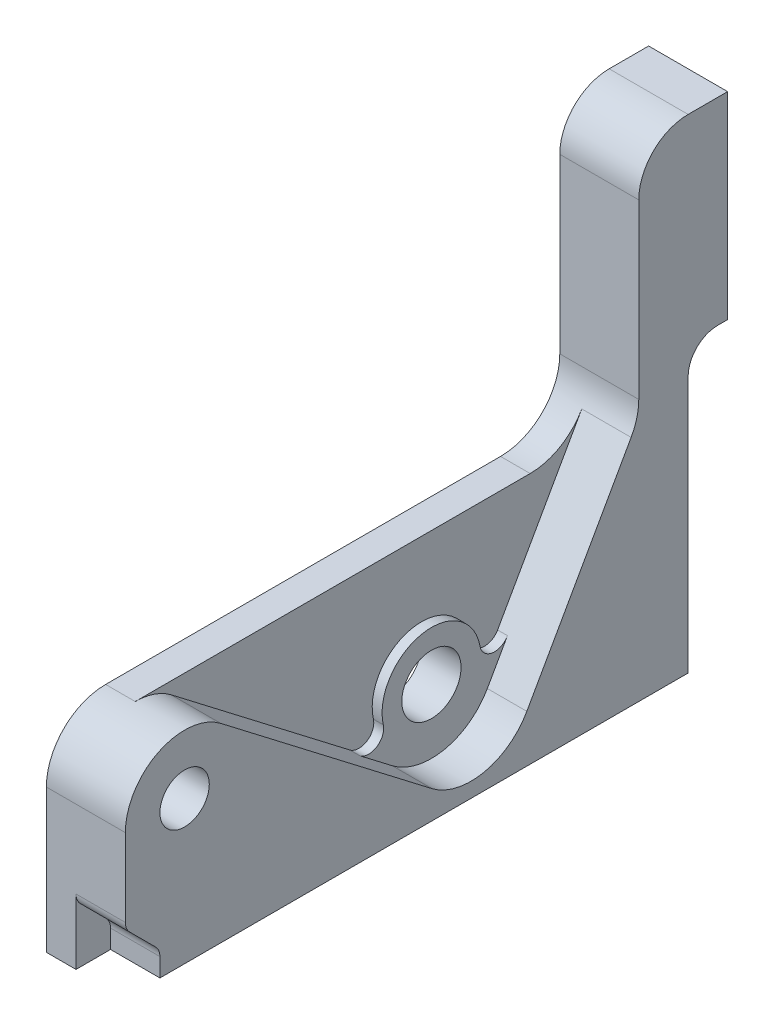
from build123d import *

# Parameters (mm, degrees)
SKETCH1_W                   = 61
SKETCH1_H                   = 49
SKETCH1_R                   = 2.5
SKETCH1_R_2                 = 3
BOSS_EXTRUDE1_DEPTH         = 8
CUT_EXTRUDE2_REACH          = 80.651
SKETCH3_W                   = 4
SKETCH3_H                   = 29
FILLET2_R                   = 3
TAP_DRILL_FOR_M3_TAP1_D     = 2.5
TAP_DRILL_FOR_M3_TAP1_DEPTH = 10
TAP_DRILL_FOR_M3_TAP1_TIP   = 0.751075774
TAP_DRILL_FOR_M3_TAP2_D     = 2.5
TAP_DRILL_FOR_M3_TAP2_DEPTH = 8
TAP_DRILL_FOR_M3_TAP2_TIP   = 0.751075774
CUT_EXTRUDE3_DEPTH          = 8
CUT_EXTRUDE4_DEPTH          = 5
SKETCH14_R                  = 3
BOSS_EXTRUDE2_DEPTH         = 1
FILLET3_R                   = 5
FILLET4_R                   = 1.5


with BuildPart() as part:
    # Sketch1 → Boss-Extrude1 (new body)
    with BuildSketch(Plane(origin=(0, 0, 0), x_dir=(0, 0, -1), z_dir=(1, 0, 0))):
        with Locations((30.5, 24.5)):
            Rectangle(SKETCH1_W, SKETCH1_H)
        with Locations((6, 14.5)):
            Circle(SKETCH1_R, mode=Mode.SUBTRACT)
        with Locations((35, 8)):
            Circle(SKETCH1_R_2, mode=Mode.SUBTRACT)
    extrude(amount=BOSS_EXTRUDE1_DEPTH)

    # Sketch3 → Cut-Extrude2 (cut, up to next)
    with BuildSketch(Plane(origin=(8, 0, 0), x_dir=(0, 0, -1), z_dir=(1, 0, 0)), mode=Mode.PRIVATE) as cut_extrude2_sk1:
        with Locations((59, 14.5)):
            Rectangle(SKETCH3_W, SKETCH3_H)
    cut_extrude2_tool1 = extrude(cut_extrude2_sk1.sketch, amount=-CUT_EXTRUDE2_REACH, mode=Mode.PRIVATE) & part.part
    add(cut_extrude2_tool1.solids().sort_by_distance((8, 14.5, -59))[0], mode=Mode.SUBTRACT)

    # Fillet2
    fillet2_edges = [part.edges().sort_by_distance(p)[0] for p in [
        (4, 29, -57),
    ]]
    fillet(fillet2_edges, radius=FILLET2_R)

    # Tap Drill for M3 Tap1
    with Locations(Plane(origin=(0, 0, 0), x_dir=(-1, 0, 0), z_dir=(0, -1, 0))):
        with Locations((-4, 48), (-4, 12)):
            Hole(TAP_DRILL_FOR_M3_TAP1_D / 2, depth=TAP_DRILL_FOR_M3_TAP1_DEPTH)
            with Locations((0, 0, -(TAP_DRILL_FOR_M3_TAP1_DEPTH + TAP_DRILL_FOR_M3_TAP1_TIP / 2))):  # 118° drill point
                Cone(0, TAP_DRILL_FOR_M3_TAP1_D / 2, TAP_DRILL_FOR_M3_TAP1_TIP, mode=Mode.SUBTRACT)

    # Tap Drill for M3 Tap2
    with Locations(Plane(origin=(0, 0, -61), x_dir=(-1, 0, 0), z_dir=(0, 0, -1))):
        with Locations((-4, 44), (-4, 34)):
            Hole(TAP_DRILL_FOR_M3_TAP2_D / 2, depth=TAP_DRILL_FOR_M3_TAP2_DEPTH)
            with Locations((0, 0, -(TAP_DRILL_FOR_M3_TAP2_DEPTH + TAP_DRILL_FOR_M3_TAP2_TIP / 2))):  # 118° drill point
                Cone(0, TAP_DRILL_FOR_M3_TAP2_D / 2, TAP_DRILL_FOR_M3_TAP2_TIP, mode=Mode.SUBTRACT)

    # Sketch9 → Cut-Extrude3 (cut)
    with BuildSketch(Plane(origin=(8, 0, 0), x_dir=(0, 0, -1), z_dir=(1, 0, 0))):
        with BuildLine():
            Line((6, 20.5), (46, 20.5))
            ThreePointArc((46, 20.5), (50.242640687, 22.257359313), (52, 26.5))
            Line((52, 26.5), (52, 49))
            Line((52, 49), (0, 49))
            Line((0, 49), (0, 14.5))
            ThreePointArc((0, 14.5), (1.757359313, 18.742640687), (6, 20.5))
        make_face()
    extrude(amount=-CUT_EXTRUDE3_DEPTH, mode=Mode.SUBTRACT)

    # Sketch13 → Cut-Extrude4 (cut)
    with BuildSketch(Plane(origin=(8, 0, 0), x_dir=(0, 0, -1), z_dir=(1, 0, 0))):
        with BuildLine():
            Line((9.653047907, 19.259752199), (31.042531435, 2.843601785))
            ThreePointArc((31.042531435, 2.843601785), (36.300887291, 1.631507851), (40.662647671, 4.808695979))
            Line((40.662647671, 4.808695979), (51.227059389, 23.554180904))
            ThreePointArc((51.227059389, 23.554180904), (51.803548756, 24.97723218), (52, 26.5))
            Line((52, 26.5), (0, 26.5))
            Line((0, 26.5), (0, 14.5))
            ThreePointArc((0, 14.5), (3.346538811, 19.88137006), (9.653047907, 19.259752199))
        make_face()
        Polygon((0, 6), (3.5, 2.5), (3.5, 0), (0, 0), align=None)
    extrude(amount=-CUT_EXTRUDE4_DEPTH, mode=Mode.SUBTRACT)

    # Sketch14 → Boss-Extrude2 (add)
    with BuildSketch(Plane(origin=(3, 0, 0), x_dir=(0, 0, -1), z_dir=(1, 0, 0))):
        with BuildLine():
            Line((27.747742168, 5.372309694), (31.042531435, 2.843601785))
            ThreePointArc((31.042531435, 2.843601785), (36.300887291, 1.631507851), (40.662647671, 4.808695979))
            Line((40.662647671, 4.808695979), (42.701798604, 8.426964))
            ThreePointArc((42.701798604, 8.426964), (41.146254574, 7.684192991), (39.919256736, 8.894937519))
            ThreePointArc((39.919256736, 8.894937519), (33.999317468, 12.898840115), (30.123849342, 6.894036726))
            ThreePointArc((30.123849342, 6.894036726), (29.469968742, 5.299086519), (27.747742168, 5.372309694))
        make_face()
        with Locations((35, 8)):
            Circle(SKETCH14_R, mode=Mode.SUBTRACT)
    extrude(amount=BOSS_EXTRUDE2_DEPTH)

    # Fillet3
    fillet3_edges = [part.edges().sort_by_distance(p)[0] for p in [
        (4, 49, -52),
    ]]
    fillet(fillet3_edges, radius=FILLET3_R)

    # Fillet4
    fillet4_edges = [part.edges().sort_by_distance(p)[0] for p in [
        (5.5, 6, 0),
        (5.5, 2.5, -3.5),
    ]]
    fillet(fillet4_edges, radius=FILLET4_R)


solid = part.part
